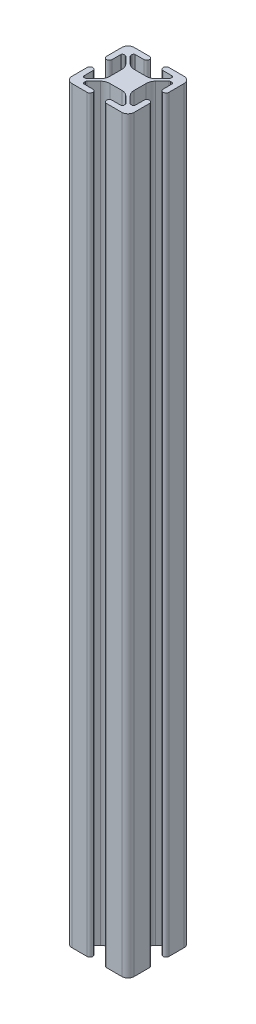
from build123d import *

# Parameters (mm, degrees)
EXTRUDE_1_DEPTH = 240


with BuildPart() as part:
    # 草图1 → 凸台-拉伸1 (new body)
    with BuildSketch(Plane(origin=(0, 0, 0), x_dir=(1, 0, 0), z_dir=(0, 1, 0))):
        with BuildLine():
            Line((-1.042752475, -10.085861632), (3.857247525, -10.085861632))
            ThreePointArc((3.857247525, -10.085861632), (4.757247525, -10.985861632), (3.857247525, -11.885861632))
            Line((3.857247525, -11.885861632), (1.076161722, -11.885861632))
            ThreePointArc((1.076161722, -11.885861632), (0.722608332, -12.032308241), (0.576161722, -12.385861632))
            Line((0.576161722, -12.385861632), (0.576161722, -12.790788968))
            ThreePointArc((0.576161722, -12.790788968), (0.614221956, -12.982130685), (0.722608332, -13.144342359))
            Line((0.722608332, -13.144342359), (2.885447948, -15.307181975))
            ThreePointArc((2.885447948, -15.307181975), (3.858717994, -15.957500229), (5.006768291, -16.185861632))
            Line((5.006768291, -16.185861632), (8.907726758, -16.185861632))
            ThreePointArc((8.907726758, -16.185861632), (10.055777055, -15.957500229), (11.029047102, -15.307181975))
            Line((11.029047102, -15.307181975), (13.191886718, -13.144342359))
            ThreePointArc((13.191886718, -13.144342359), (13.300273094, -12.982130685), (13.338333327, -12.790788968))
            Line((13.338333327, -12.790788968), (13.338333327, -12.385861632))
            ThreePointArc((13.338333327, -12.385861632), (13.191886718, -12.032308241), (12.838333327, -11.885861632))
            Line((12.838333327, -11.885861632), (10.057247525, -11.885861632))
            ThreePointArc((10.057247525, -11.885861632), (9.157247525, -10.985861632), (10.057247525, -10.085861632))
            Line((10.057247525, -10.085861632), (14.957247525, -10.085861632))
            ThreePointArc((14.957247525, -10.085861632), (16.371461087, -10.671648069), (16.957247525, -12.085861632))
            Line((16.957247525, -12.085861632), (16.957247525, -16.985861632))
            ThreePointArc((16.957247525, -16.985861632), (16.057247525, -17.885861632), (15.157247525, -16.985861632))
            Line((15.157247525, -16.985861632), (15.157247525, -14.204775829))
            ThreePointArc((15.157247525, -14.204775829), (15.010800915, -13.851222438), (14.657247525, -13.704775829))
            Line((14.657247525, -13.704775829), (14.252320188, -13.704775829))
            ThreePointArc((14.252320188, -13.704775829), (14.060978472, -13.742836063), (13.898766797, -13.851222438))
            Line((13.898766797, -13.851222438), (11.735927181, -16.014062054))
            ThreePointArc((11.735927181, -16.014062054), (11.085608927, -16.987332101), (10.857247525, -18.135382398))
            Line((10.857247525, -18.135382398), (10.857247525, -22.036340865))
            ThreePointArc((10.857247525, -22.036340865), (11.085608927, -23.184391162), (11.735927181, -24.157661209))
            Line((11.735927181, -24.157661209), (13.898766797, -26.320500825))
            ThreePointArc((13.898766797, -26.320500825), (14.060978472, -26.4288872), (14.252320188, -26.466947434))
            Line((14.252320188, -26.466947434), (14.657247525, -26.466947434))
            ThreePointArc((14.657247525, -26.466947434), (15.010800915, -26.320500825), (15.157247525, -25.966947434))
            Line((15.157247525, -25.966947434), (15.157247525, -23.185861632))
            ThreePointArc((15.157247525, -23.185861632), (16.057247525, -22.285861632), (16.957247525, -23.185861632))
            Line((16.957247525, -23.185861632), (16.957247525, -28.085861632))
            ThreePointArc((16.957247525, -28.085861632), (16.371461087, -29.500075194), (14.957247525, -30.085861632))
            Line((14.957247525, -30.085861632), (10.057247525, -30.085861632))
            ThreePointArc((10.057247525, -30.085861632), (9.157247525, -29.185861632), (10.057247525, -28.285861632))
            Line((10.057247525, -28.285861632), (12.838333327, -28.285861632))
            ThreePointArc((12.838333327, -28.285861632), (13.191886718, -28.139415022), (13.338333327, -27.785861632))
            Line((13.338333327, -27.785861632), (13.338333327, -27.380934295))
            ThreePointArc((13.338333327, -27.380934295), (13.300273094, -27.189592579), (13.191886718, -27.027380904))
            Line((13.191886718, -27.027380904), (11.029047102, -24.864541288))
            ThreePointArc((11.029047102, -24.864541288), (10.055777055, -24.214223034), (8.907726758, -23.985861632))
            Line((8.907726758, -23.985861632), (5.006768291, -23.985861632))
            ThreePointArc((5.006768291, -23.985861632), (3.858717994, -24.214223034), (2.885447948, -24.864541288))
            Line((2.885447948, -24.864541288), (0.722608332, -27.027380904))
            ThreePointArc((0.722608332, -27.027380904), (0.614221956, -27.189592579), (0.576161722, -27.380934295))
            Line((0.576161722, -27.380934295), (0.576161722, -27.785861632))
            ThreePointArc((0.576161722, -27.785861632), (0.722608332, -28.139415022), (1.076161722, -28.285861632))
            Line((1.076161722, -28.285861632), (3.857247525, -28.285861632))
            ThreePointArc((3.857247525, -28.285861632), (4.757247525, -29.185861632), (3.857247525, -30.085861632))
            Line((3.857247525, -30.085861632), (-1.042752475, -30.085861632))
            ThreePointArc((-1.042752475, -30.085861632), (-2.456966038, -29.500075194), (-3.042752475, -28.085861632))
            Line((-3.042752475, -28.085861632), (-3.042752475, -23.185861632))
            ThreePointArc((-3.042752475, -23.185861632), (-2.142752475, -22.285861632), (-1.242752475, -23.185861632))
            Line((-1.242752475, -23.185861632), (-1.242752475, -25.966947434))
            ThreePointArc((-1.242752475, -25.966947434), (-1.096305866, -26.320500825), (-0.742752475, -26.466947434))
            Line((-0.742752475, -26.466947434), (-0.337825138, -26.466947434))
            ThreePointArc((-0.337825138, -26.466947434), (-0.146483422, -26.4288872), (0.015728252, -26.320500825))
            Line((0.015728252, -26.320500825), (2.178567868, -24.157661209))
            ThreePointArc((2.178567868, -24.157661209), (2.828886122, -23.184391162), (3.057247525, -22.036340865))
            Line((3.057247525, -22.036340865), (3.057247525, -18.135382398))
            ThreePointArc((3.057247525, -18.135382398), (2.828886122, -16.987332101), (2.178567868, -16.014062054))
            Line((2.178567868, -16.014062054), (0.015728252, -13.851222438))
            ThreePointArc((0.015728252, -13.851222438), (-0.146483422, -13.742836063), (-0.337825138, -13.704775829))
            Line((-0.337825138, -13.704775829), (-0.742752475, -13.704775829))
            ThreePointArc((-0.742752475, -13.704775829), (-1.096305866, -13.851222438), (-1.242752475, -14.204775829))
            Line((-1.242752475, -14.204775829), (-1.242752475, -16.985861632))
            ThreePointArc((-1.242752475, -16.985861632), (-2.142752475, -17.885861632), (-3.042752475, -16.985861632))
            Line((-3.042752475, -16.985861632), (-3.042752475, -12.085861632))
            ThreePointArc((-3.042752475, -12.085861632), (-2.456966038, -10.671648069), (-1.042752475, -10.085861632))
        make_face()
    extrude(amount=EXTRUDE_1_DEPTH)


solid = part.part
